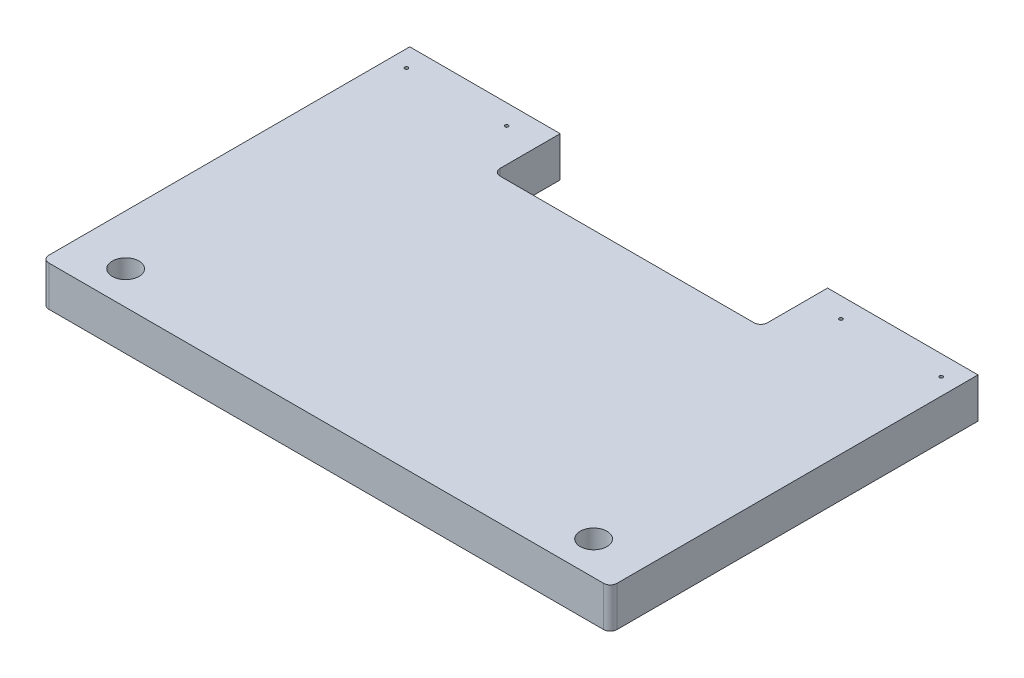
from build123d import *

# Parameters (mm, degrees)
SKETCH1_R           = 4
SKETCH1_R_2         = 0.5
BOSS_EXTRUDE1_DEPTH = 12
FILLET1_R           = 2


with BuildPart() as part:
    # Sketch1 → Boss-Extrude1 (new body)
    with BuildSketch(Plane(origin=(0, 0, 0), x_dir=(1, 0, 0), z_dir=(0, 1, 0))):
        Polygon((0, 0), (170, 0), (170, 110), (125, 110), (125, 90), (45, 90), (45, 110), (0, 110), align=None)
        with Locations(Location((155, 10, 0), (0, 0, 270))):
            Circle(SKETCH1_R, mode=Mode.SUBTRACT)
        with Locations(Location((15, 10, 0), (0, 0, 90))):
            Circle(SKETCH1_R, mode=Mode.SUBTRACT)
        with Locations(Location((5, 104, 0), (0, 0, 270))):
            Circle(SKETCH1_R_2, mode=Mode.SUBTRACT)
        with Locations(Location((35, 104, 0), (0, 0, 270))):
            Circle(SKETCH1_R_2, mode=Mode.SUBTRACT)
        with Locations(Location((165, 104, 0), (0, 0, 90))):
            Circle(SKETCH1_R_2, mode=Mode.SUBTRACT)
        with Locations(Location((135, 104, 0), (0, 0, 90))):
            Circle(SKETCH1_R_2, mode=Mode.SUBTRACT)
    extrude(amount=BOSS_EXTRUDE1_DEPTH)

    # Fillet1
    fillet1_edges = [part.edges().sort_by_distance(p)[0] for p in [
        (45, 6, -90),
        (125, 6, -90),
        (170, 6, 0),
        (0, 6, 0),
    ]]
    fillet(fillet1_edges, radius=FILLET1_R)


solid = part.part
